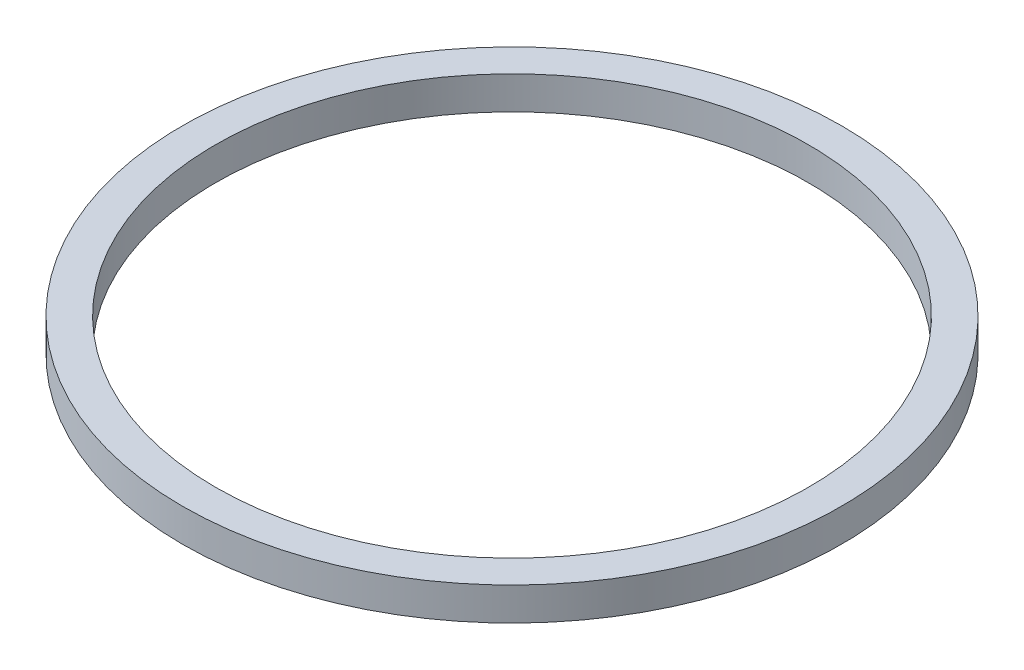
from build123d import *

# Parameters (mm, degrees)
IZIM1_R                     = 10
Y_KSEKLIK_EKSTR_ZYON1_DEPTH = 1
IZIM2_R                     = 9
KES_EKSTR_ZYON1_DEPTH       = 1


with BuildPart() as part:
    # Çizim1 → Yükseklik-Ekstrüzyon1 (new body)
    with BuildSketch(Plane(origin=(0, 0, 0), x_dir=(1, 0, 0), z_dir=(0, 1, 0))):
        with Locations(Location((0, 0, 0), (0, 0, 270))):
            Circle(IZIM1_R)
    extrude(amount=Y_KSEKLIK_EKSTR_ZYON1_DEPTH)

    # Çizim2 → Kes-Ekstrüzyon1 (cut)
    with BuildSketch(Plane(origin=(0, 1, 0), x_dir=(1, 0, 0), z_dir=(0, 1, 0))):
        with Locations(Location((0, 0, 0), (0, 0, 270))):
            Circle(IZIM2_R)
    extrude(amount=-KES_EKSTR_ZYON1_DEPTH, mode=Mode.SUBTRACT)


solid = part.part
